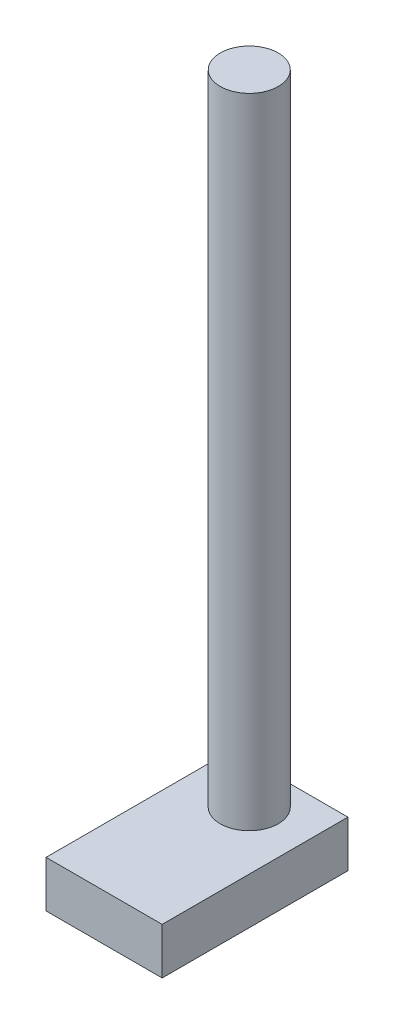
from build123d import *

# Parameters (mm, degrees)
SKETCH1_W           = 100
SKETCH1_H           = 160
BOSS_EXTRUDE1_DEPTH = 40
SKETCH2_R           = 25
BOSS_EXTRUDE2_DEPTH = 590


with BuildPart() as part:
    # Sketch1 → Boss-Extrude1 (new body)
    with BuildSketch(Plane(origin=(0, 0, 0), x_dir=(1, 0, 0), z_dir=(0, 1, 0))):
        with Locations((-10.009659714, -61.441979522)):
            Rectangle(SKETCH1_W, SKETCH1_H)
    extrude(amount=BOSS_EXTRUDE1_DEPTH)

    # Sketch2 → Boss-Extrude2 (add)
    with BuildSketch(Plane(origin=(0, 0, 0), x_dir=(1, 0, 0), z_dir=(0, 1, 0))):
        with Locations(Location((-10.009659714, -16.441979522, 0), (0, 0, 270))):
            Circle(SKETCH2_R)
    extrude(amount=BOSS_EXTRUDE2_DEPTH)


solid = part.part
